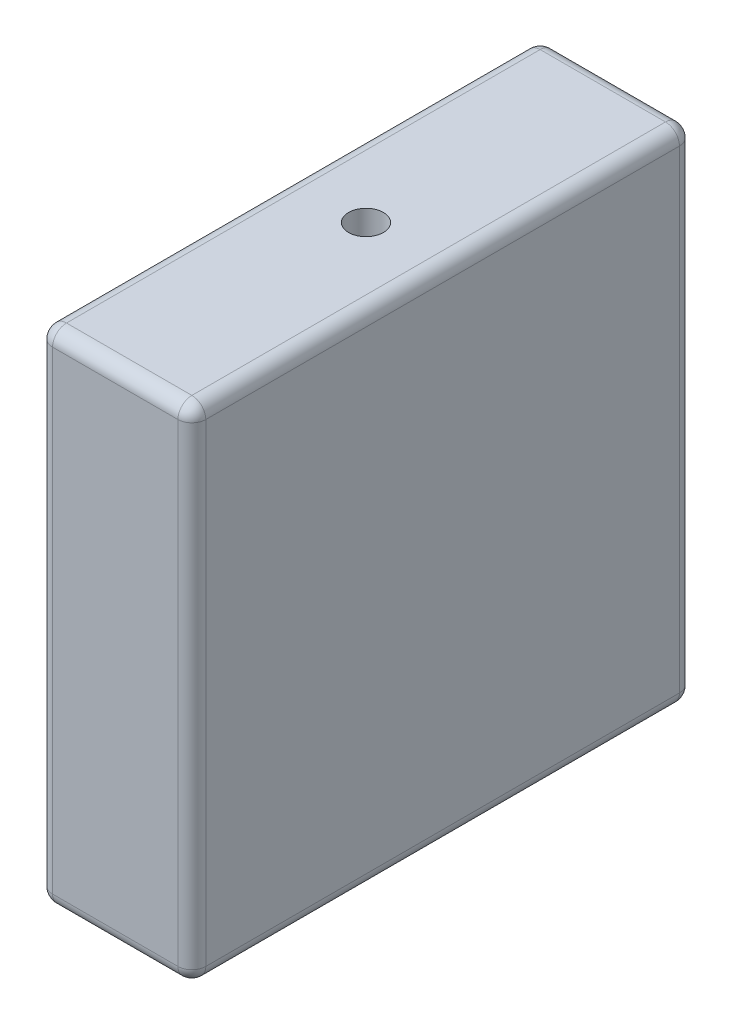
from build123d import *

# Parameters (mm, degrees)
SKETCH_1_W          = 36
SKETCH_1_H          = 36
EXTRUDE_1_DEPTH     = 11
FILLET_1_R          = 1
SKETCH_2_R          = 1.25
CUT_EXTRUDE_1_DEPTH = 36


with BuildPart() as part:
    # 草图1 → 凸台-拉伸1 (new body)
    with BuildSketch(Plane(origin=(0, 0, 0), x_dir=(0, 0, -1), z_dir=(1, 0, 0))):
        with Locations((-12.735278258, 9.396435054)):
            Rectangle(SKETCH_1_W, SKETCH_1_H)
    extrude(amount=EXTRUDE_1_DEPTH)

    # 圆角1
    fillet_1_edges = [part.edges().sort_by_distance(p)[0] for p in [
        (11, 9.396435054, -5.264721742),
        (11, 27.396435054, 12.735278258),
        (11, 9.396435054, 30.735278258),
        (0, 27.396435054, 12.735278258),
        (0, 9.396435054, -5.264721742),
        (0, -8.603564946, 12.735278258),
        (0, 9.396435054, 30.735278258),
        (5.5, 27.396435054, 30.735278258),
        (5.5, 27.396435054, -5.264721742),
        (5.5, -8.603564946, -5.264721742),
        (5.5, -8.603564946, 30.735278258),
        (11, -8.603564946, 12.735278258),
    ]]
    fillet(fillet_1_edges, radius=FILLET_1_R)

    # 草图2 → 切除-拉伸1 (cut)
    with BuildSketch(Plane.XZ.offset(8.603564946)):
        with Locations(Location((5.5, 12.735278258, 0), (0, 0, 270))):
            Circle(SKETCH_2_R)
    extrude(amount=-CUT_EXTRUDE_1_DEPTH, mode=Mode.SUBTRACT)


solid = part.part
